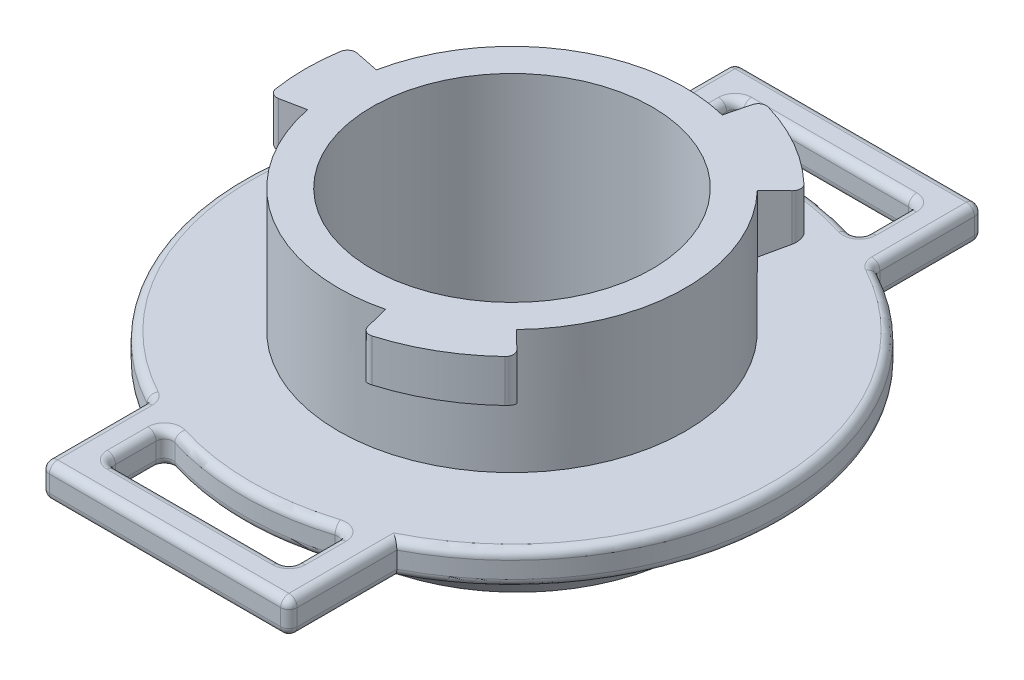
from build123d import *

# Parameters (mm, degrees)
SKETCH1_W           = 9.2
SKETCH1_H           = 9.5
REVOLVE2_ANGLE      = 22.9
SKETCH4_W           = 3.5
SKETCH4_H           = 2
REVOLVE3_ANGLE      = 32
FILLET2_R           = 0.5
BOSS_EXTRUDE7_START = 2
BOSS_EXTRUDE7_DEPTH = 2
FILLET6_R           = 0.5
SKETCH22_R          = 9.75
BOSS_EXTRUDE8_DEPTH = 3.493734714
BOSS_EXTRUDE8_TAPER = 1
SKETCH23_R          = 8.489016634
CUT_EXTRUDE1_DEPTH  = 30.589307996
SKETCH24_R          = 11
SKETCH24_R_2        = 8.489016634
BOSS_EXTRUDE9_DEPTH = 1
BOSS_EXTRUDE9_DRAFT = 30


with BuildPart() as part:
    # Sketch1 → Revolve1 (revolve)
    with BuildSketch(Plane.XY, mode=Mode.PRIVATE) as revolve1_sk:
        Polygon((10.5, 9.5), (9.2, 9.5), (9.2, 0), (16.3, 0), (16.3, 2), (10.5, 2), align=None)
        with Locations((4.6, 4.75)):
            Rectangle(SKETCH1_W, SKETCH1_H)
    revolve(revolve1_sk.sketch.rotate(Axis((0, 78.807142857, 0), (0, -1, 0)), 90), axis=Axis((0, 78.807142857, 0), (0, -1, 0)))

    # Sketch1<7> → Revolve2 (revolve, symmetric)
    with BuildSketch(Plane.XY) as revolve2_sk:
        Polygon((-12.5, 6.932615316), (-10.5, 6), (-10.5, 9.5), (-12.5, 9.5), align=None)
    revolve(axis=Axis((0, 78.807142857, 0), (0, -1, 0)), revolution_arc=REVOLVE2_ANGLE / 2)
    revolve(revolve2_sk.sketch, axis=Axis((0, 78.807142857, 0), (0, 1, 0)), revolution_arc=REVOLVE2_ANGLE / 2)

    # Sketch4 → Revolve3 (revolve, symmetric)
    with BuildSketch(Plane(origin=(0, 0, 0), x_dir=(0, 1, 0), z_dir=(-0.8660254037844364, 0, -0.5000000000000041))) as revolve3_sk:
        with Locations((7.75, 11.5)):
            Rectangle(SKETCH4_W, SKETCH4_H)
    revolve3 = revolve(axis=Axis((0, -50, 0), (0, 1, 0)), revolution_arc=REVOLVE3_ANGLE / 2)
    revolve3 = revolve3 + revolve(revolve3_sk.sketch, axis=Axis((0, -50, 0), (0, -1, 0)), revolution_arc=REVOLVE3_ANGLE / 2)

    # Mirror1: Revolve3 across plane
    add(revolve3.mirror(Plane.XY))

    # Fillet2
    fillet2_edges = [part.edges().sort_by_distance(p)[0] for p in [
        (-12.25122891, 8.216307658, -2.481408912),
        (-12.25122891, 8.216307658, 2.481408912),
        (8.991747504, 7.75, -8.683229631),
        (3.024023695, 7.75, -12.128696578),
        (3.024023695, 7.75, 12.128696578),
        (8.991747504, 7.75, 8.683229631),
    ]]
    fillet(fillet2_edges, radius=FILLET2_R)

    # Sketch1<9> → Cut-Revolve1 (revolve, cut)
    with BuildSketch(Plane.XY):
        Polygon((-12.5, 6), (-10.5, 6), (-12.5, 6.932615316), align=None)
    revolve(axis=Axis((0, -50, 0), (0, 1, 0)), mode=Mode.SUBTRACT)

    # Sketch21 → Boss-Extrude7 (add)
    with BuildSketch(Plane(origin=(0, 0, 0), x_dir=(1, 0, 0), z_dir=(0, 1, 0)).offset(BOSS_EXTRUDE7_START)):
        with BuildLine():
            ThreePointArc((-5.5, -15.344054223), (-6.514606767, -14.941549407), (-7.5, -14.472042012))
            Line((-7.5, -14.472042012), (-7.5, -21))
            Line((-7.5, -21), (7.5, -21))
            Line((7.5, -21), (7.5, -14.472042012))
            ThreePointArc((7.5, -14.472042012), (6.514606767, -14.941549407), (5.5, -15.344054223))
            Line((5.5, -15.344054223), (5.5, -19))
            Line((5.5, -19), (-5.5, -19))
            Line((-5.5, -19), (-5.5, -15.344054223))
        make_face()
        with BuildLine():
            Line((7.5, 21), (-7.5, 21))
            Line((-7.5, 21), (-7.5, 14.472042012))
            ThreePointArc((-7.5, 14.472042012), (-6.514606767, 14.941549407), (-5.5, 15.344054223))
            Line((-5.5, 15.344054223), (-5.5, 19))
            Line((-5.5, 19), (5.5, 19))
            Line((5.5, 19), (5.5, 15.344054223))
            ThreePointArc((5.5, 15.344054223), (6.514606767, 14.941549407), (7.5, 14.472042012))
            Line((7.5, 14.472042012), (7.5, 21))
        make_face()
    extrude(amount=-BOSS_EXTRUDE7_DEPTH)

    # Fillet6
    fillet6_edges = [part.edges().sort_by_distance(p)[0] for p in [
        (16.3, 0, 0),
        (0, 0, 16.3),
        (16.3, 2, 0),
        (0, 2, 16.3),
        (5.5, 2, 17.172027112),
        (5.5, 1, 15.344054223),
        (5.5, 0, 17.172027112),
        (5.5, 1, 19),
        (-5.5, 1, 19),
        (-5.5, 1, 15.344054223),
        (-7.5, 2, 17.736021006),
        (-7.5, 1, 14.472042012),
        (-7.5, 0, 17.736021006),
        (0, 2, 21),
        (-7.5, 1, 21),
        (0, 0, 21),
        (7.5, 1, 21),
        (7.5, 0, 17.736021006),
        (-5.5, 0, 17.172027112),
        (0, 0, 19),
        (0, 2, 19),
        (-5.5, 2, 17.172027112),
        (7.5, 2, 17.736021006),
        (0, 0, -16.3),
        (-16.3, 0, 0),
        (0, 2, -16.3),
        (-16.3, 2, 0),
        (-5.5, 0, -17.172027112),
        (0, 0, -21),
        (7.5, 0, -17.736021006),
        (5.5, 2, -17.172027112),
        (5.5, 1, -19),
        (5.5, 0, -17.172027112),
        (0, 2, -19),
        (-5.5, 1, -19),
        (0, 0, -19),
        (-5.5, 1, -15.344054223),
        (-7.5, 1, -14.472042012),
        (-7.5, 2, -17.736021006),
        (-7.5, 1, -21),
        (-7.5, 0, -17.736021006),
        (7.5, 1, -21),
        (7.5, 1, -14.472042012),
        (5.5, 1, -15.344054223),
        (7.5, 2, -17.736021006),
        (0, 2, -21),
        (-5.5, 2, -17.172027112),
    ]]
    fillet(fillet6_edges, radius=FILLET6_R)

    # Sketch22 → Boss-Extrude8 (add)
    with BuildSketch(Plane(origin=(0, 0, 0), x_dir=(-1, 0, 0), z_dir=(0, -1, 0))):
        Circle(SKETCH22_R)
    extrude(amount=BOSS_EXTRUDE8_DEPTH, taper=BOSS_EXTRUDE8_TAPER)

    # Sketch23 → Cut-Extrude1 (cut, through all)
    with BuildSketch(Plane(origin=(0, -3.493734714, 0), x_dir=(-1, 0, 0), z_dir=(0, -1, 0))):
        with Locations(Location((0, 0, 0), (0, 0, 90))):
            Circle(SKETCH23_R)
    extrude(amount=-CUT_EXTRUDE1_DEPTH, mode=Mode.SUBTRACT)


with BuildPart() as boss_extrude9_tool:
    # Sketch24 → Boss-Extrude9 (with draft: the straight prism first)
    with BuildSketch(Plane(origin=(0, -3.493734714, 0), x_dir=(-1, 0, 0), z_dir=(0, -1, 0))):
        with Locations((0, 0.332966048)):
            Circle(SKETCH24_R)
        with Locations(Location((0, 0, 0), (0, 0, 90))):
            Circle(SKETCH24_R_2, mode=Mode.SUBTRACT)
    extrude(amount=BOSS_EXTRUDE9_DEPTH)
    # Boss-Extrude9: the draft: its side faces are tilted about the plane it starts from
    boss_extrude9_sides = [boss_extrude9_tool.faces().sort_by_distance(p)[0] for p in [
        (11, -3.993734714, -0.332966048),
        (0, -3.993734714, 8.489016634),
    ]]
    draft(boss_extrude9_sides, Plane(origin=(0, -3.493734714, 0), x_dir=(-1, 0, 0), z_dir=(0, -1, 0)), BOSS_EXTRUDE9_DRAFT)


with BuildPart() as part_1:
    add(part.part)

    # Boss-Extrude9: add boss_extrude9_tool
    add(boss_extrude9_tool.part)


solid = part_1.part
